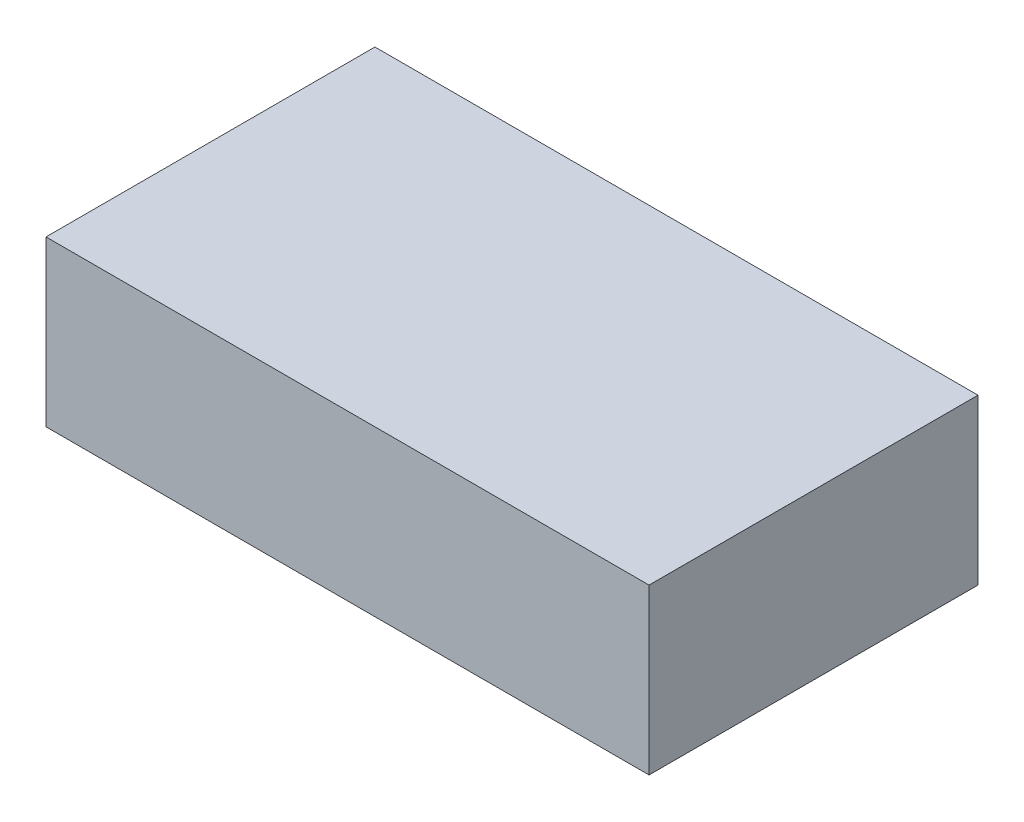
from build123d import *

# Parameters (mm, degrees)
SKETCH1_W           = 22
SKETCH1_H           = 12
BOSS_EXTRUDE1_DEPTH = 6


with BuildPart() as part:
    # Sketch1 → Boss-Extrude1 (new body)
    with BuildSketch(Plane(origin=(0, 0, 0), x_dir=(1, 0, 0), z_dir=(0, 1, 0))):
        with Locations((11, 6)):
            Rectangle(SKETCH1_W, SKETCH1_H)
    extrude(amount=BOSS_EXTRUDE1_DEPTH)


solid = part.part
